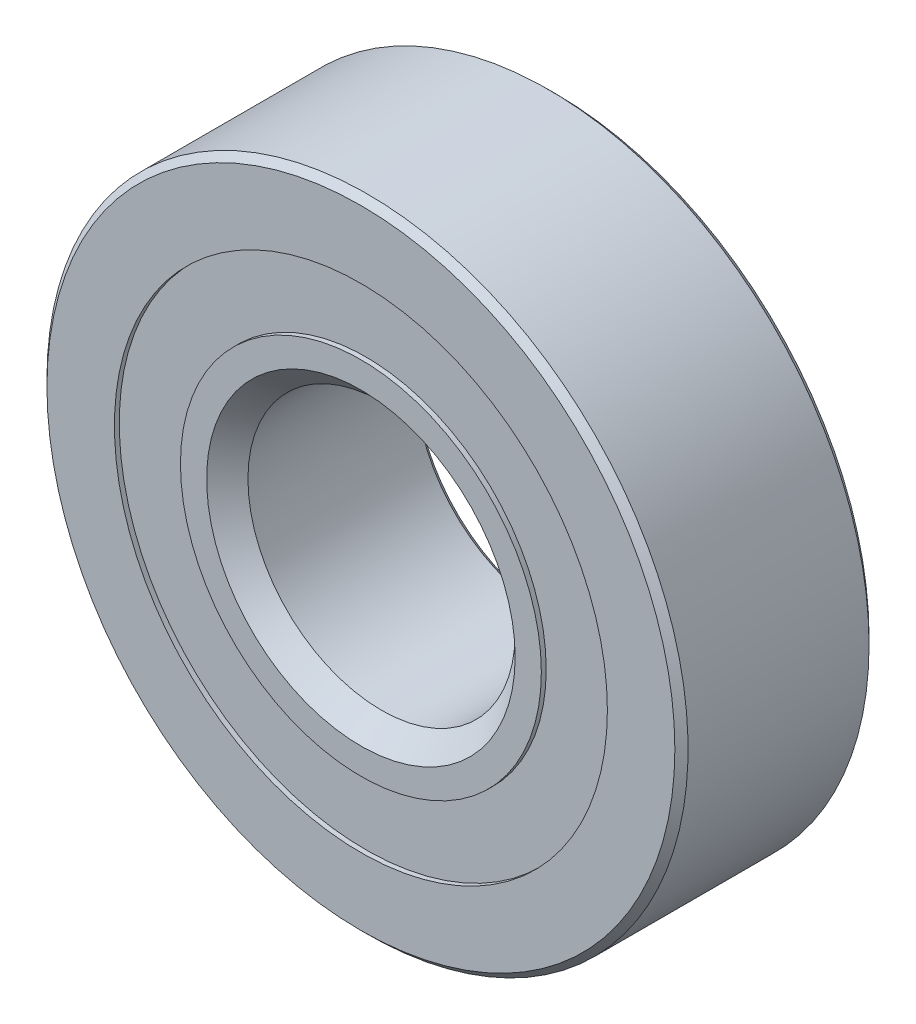
from build123d import *

# Parameters (mm, degrees)
CIRPATTERN1_COUNT  = 10
SKETCH5_W          = 1.096570016
SKETCH5_H          = 1.619409178
SKETCH6_R          = 3.2766
CUT_EXTRUDE1_DEPTH = 7.62
SKETCH7_R          = 8.001
SKETCH7_R_2        = 7.8613
CUT_EXTRUDE2_DEPTH = 7.62


with BuildPart() as part:
    # Sketch1 → Revolve1 (revolve)
    with BuildSketch(Plane(origin=(0, 0, 0), x_dir=(0, 0, -1), z_dir=(1, 0, 0))):
        with BuildLine():
            Line((2.143125, 7.9375), (-2.143125, 7.9375))
            Line((-2.143125, 7.9375), (-2.38125, 7.699375))
            Line((-2.38125, 7.699375), (-2.38125, 6.044711538))
            Line((-2.38125, 6.044711538), (-1.058333333, 6.044711538))
            ThreePointArc((-1.058333333, 6.044711538), (0, 6.721867484), (1.058333333, 6.044711538))
            Line((1.058333333, 6.044711538), (2.38125, 6.044711538))
            Line((2.38125, 6.044711538), (2.38125, 7.699375))
            Line((2.38125, 7.699375), (2.143125, 7.9375))
        make_face()
    revolve(axis=Axis((0, 0, 2.38125), (0, 0, -1)))

    # Sketch7 → Cut-Extrude2 (cut)
    with BuildSketch(Plane(origin=(0, 0, -2.38125), x_dir=(-1, 0, 0), z_dir=(0, 0, -1))):
        Circle(SKETCH7_R)
        Circle(SKETCH7_R_2, mode=Mode.SUBTRACT)
    extrude(amount=-CUT_EXTRUDE2_DEPTH, mode=Mode.SUBTRACT)


with BuildPart() as body_2:
    # Sketch3 → Revolve3 (revolve)
    with BuildSketch(Plane(origin=(0, 0, 0), x_dir=(0, 0, -1), z_dir=(1, 0, 0))):
        with BuildLine():
            Line((-2.2621875, 4.30623986), (-1.738763898, 3.782816258))
            Line((-1.738763898, 3.782816258), (0, 3.782816258))
            Line((0, 3.782816258), (0, 4.390632516))
            ThreePointArc((0, 4.390632516), (0.628213662, 4.574409018), (1.058333333, 5.067788462))
            Line((1.058333333, 5.067788462), (2.38125, 5.067788462))
            Line((2.38125, 5.067788462), (2.38125, 3.413125))
            Line((2.38125, 3.413125), (2.143125, 3.175))
            Line((2.143125, 3.175), (-1.773433742, 3.175))
            Line((-1.773433742, 3.175), (-2.38125, 3.782816258))
            Line((-2.38125, 3.782816258), (-2.38125, 4.42530236))
            Line((-2.38125, 4.42530236), (-2.2621875, 4.42530236))
            Line((-2.2621875, 4.42530236), (-2.2621875, 4.30623986))
        make_face()
    revolve(axis=Axis((0, 0, 2.38125), (0, 0, -1)))

    # Sketch6 → Cut-Extrude1 (cut)
    with BuildSketch(Plane(origin=(0, 0, -2.38125), x_dir=(-1, 0, 0), z_dir=(0, 0, -1))):
        Circle(SKETCH6_R)
    extrude(amount=-CUT_EXTRUDE1_DEPTH, mode=Mode.SUBTRACT)


with BuildPart() as body_3:
    # Sketch4 → Revolve4 (revolve)
    with BuildSketch(Plane(origin=(0, 0, 0), x_dir=(0, 0, -1), z_dir=(1, 0, 0))):
        with BuildLine():
            Line((-1.165617484, 5.55625), (1.165617484, 5.55625))
            ThreePointArc((1.165617484, 5.55625), (0, 6.721867484), (-1.165617484, 5.55625))
        make_face()
    revolve(axis=Axis((0, 5.55625, 1.165617484), (0, 0, -1)))


with BuildPart() as cirpattern1_1:
    # CirPattern1: pattern copy
    add(body_3.part.rotate(Axis((0, 0, -2.38125), (0, 0, 1)), 1 * 360 / CIRPATTERN1_COUNT))


with BuildPart() as cirpattern1_2:
    # CirPattern1: pattern copy
    add(body_3.part.rotate(Axis((0, 0, -2.38125), (0, 0, 1)), 2 * 360 / CIRPATTERN1_COUNT))


with BuildPart() as cirpattern1_3:
    # CirPattern1: pattern copy
    add(body_3.part.rotate(Axis((0, 0, -2.38125), (0, 0, 1)), 3 * 360 / CIRPATTERN1_COUNT))


with BuildPart() as cirpattern1_4:
    # CirPattern1: pattern copy
    add(body_3.part.rotate(Axis((0, 0, -2.38125), (0, 0, 1)), 4 * 360 / CIRPATTERN1_COUNT))


with BuildPart() as cirpattern1_5:
    # CirPattern1: pattern copy
    add(body_3.part.rotate(Axis((0, 0, -2.38125), (0, 0, 1)), 5 * 360 / CIRPATTERN1_COUNT))


with BuildPart() as cirpattern1_6:
    # CirPattern1: pattern copy
    add(body_3.part.rotate(Axis((0, 0, -2.38125), (0, 0, 1)), 6 * 360 / CIRPATTERN1_COUNT))


with BuildPart() as cirpattern1_7:
    # CirPattern1: pattern copy
    add(body_3.part.rotate(Axis((0, 0, -2.38125), (0, 0, 1)), 7 * 360 / CIRPATTERN1_COUNT))


with BuildPart() as cirpattern1_8:
    # CirPattern1: pattern copy
    add(body_3.part.rotate(Axis((0, 0, -2.38125), (0, 0, 1)), 8 * 360 / CIRPATTERN1_COUNT))


with BuildPart() as cirpattern1_9:
    # CirPattern1: pattern copy
    add(body_3.part.rotate(Axis((0, 0, -2.38125), (0, 0, 1)), 9 * 360 / CIRPATTERN1_COUNT))


with BuildPart() as body_13:
    # Sketch5 → Revolve5 (revolve)
    with BuildSketch(Plane(origin=(0, 0, 0), x_dir=(0, 0, -1), z_dir=(1, 0, 0))):
        with Locations((-1.713902492, 5.235006949)):
            Rectangle(SKETCH5_W, SKETCH5_H)
        with Locations((1.713902492, 5.235006949)):
            Rectangle(SKETCH5_W, SKETCH5_H)
    revolve(axis=Axis((0, 0, 2.38125), (0, 0, -1)))


solid = Compound([part.part, body_2.part, body_3.part, cirpattern1_1.part, cirpattern1_2.part, cirpattern1_3.part, cirpattern1_4.part, cirpattern1_5.part, cirpattern1_6.part, cirpattern1_7.part, cirpattern1_8.part, cirpattern1_9.part, body_13.part])
